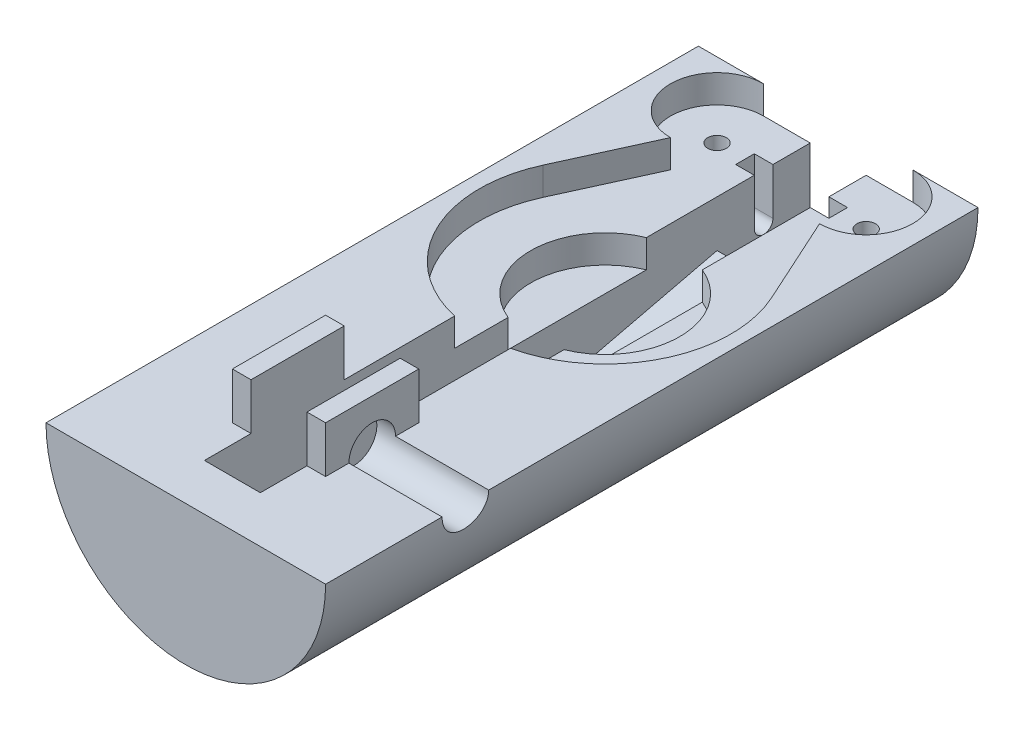
from build123d import *

# Parameters (mm, degrees)
SALIENTE_EXTRUIR1_DEPTH      = 35
SALIENTE_EXTRUIR1_DEPTH_BACK = 35
CORTAR_EXTRUIR1_DEPTH        = 3
CROQUIS4_R                   = 8
CORTAR_EXTRUIR2_DEPTH        = 3
CROQUIS5_R                   = 2.5
CORTAR_EXTRUIR3_DEPTH        = 10
CROQUIS6_W                   = 6
CROQUIS6_H                   = 10
CORTAR_EXTRUIR5_DEPTH        = 10
CROQUIS7_W                   = 2
CROQUIS7_H                   = 2
CORTAR_EXTRUIR6_DEPTH        = 5
CROQUIS8_R                   = 1
CORTAR_EXTRUIR7_DEPTH        = 2
CROQUIS9_W                   = 6
CROQUIS9_H                   = 10
CORTAR_EXTRUIR8_DEPTH        = 12
CORTAR_EXTRUIR9_DEPTH        = 5
CORTAR_EXTRUIR9_DEPTH_BACK   = 5
CROQUIS10_R                  = 1
CORTAR_EXTRUIR10_DEPTH       = 5
CORTAR_EXTRUIR10_DEPTH_BACK  = 5
CORTAR_EXTRUIR11_DEPTH       = 3
CORTAR_EXTRUIR11_DEPTH_BACK  = 3
CROQUIS14_W                  = 2
CROQUIS14_H                  = 10
SALIENTE_EXTRUIR2_DEPTH      = 5
CROQUIS15_R                  = 2.5
CORTAR_EXTRUIR12_DEPTH       = 15


with BuildPart() as part:
    # Croquis1 → Saliente-Extruir1 (new, two sides: drawn at the far end of the back side and taken through both)
    with BuildSketch(Plane.XY.offset(-SALIENTE_EXTRUIR1_DEPTH_BACK)):
        with BuildLine():
            Line((-15, 0), (15, 0))
            ThreePointArc((15, 0), (0, -15), (-15, 0))
        make_face()
    extrude(amount=SALIENTE_EXTRUIR1_DEPTH + SALIENTE_EXTRUIR1_DEPTH_BACK)

    # Croquis3 → Cortar-Extruir1 (cut)
    with BuildSketch(Plane(origin=(0, 0, 0), x_dir=(1, 0, 0), z_dir=(0, 1, 0))):
        with BuildLine():
            Line((-8, 25), (-12.284525276, 15.598253186))
            ThreePointArc((-12.284525276, 15.598253186), (0, -3.5), (12.284525276, 15.598253186))
            Line((12.284525276, 15.598253186), (8, 25))
            ThreePointArc((8, 25), (13, 30), (8, 35))
            Line((8, 35), (-8, 35))
            ThreePointArc((-8, 35), (-13, 30), (-8, 25))
        make_face()
    extrude(amount=-CORTAR_EXTRUIR1_DEPTH, mode=Mode.SUBTRACT)

    # Croquis4 → Cortar-Extruir2 (cut)
    with BuildSketch(Plane(origin=(0, -3, 0), x_dir=(1, 0, 0), z_dir=(0, 1, 0))):
        with Locations((0, 10)):
            Circle(CROQUIS4_R)
    extrude(amount=-CORTAR_EXTRUIR2_DEPTH, mode=Mode.SUBTRACT)

    # Croquis5 → Cortar-Extruir3 (cut)
    with BuildSketch(Plane(origin=(0, -6, 0), x_dir=(1, 0, 0), z_dir=(0, 1, 0))):
        with Locations((0, 10)):
            Circle(CROQUIS5_R)
    extrude(amount=-CORTAR_EXTRUIR3_DEPTH, mode=Mode.SUBTRACT)

    # Croquis6 → Cortar-Extruir5 (cut)
    with BuildSketch(Plane(origin=(0, -3, 0), x_dir=(1, 0, 0), z_dir=(0, 1, 0))):
        with Locations((0, 30)):
            Rectangle(CROQUIS6_W, CROQUIS6_H)
    extrude(amount=-CORTAR_EXTRUIR5_DEPTH, mode=Mode.SUBTRACT)

    # Croquis7 → Cortar-Extruir6 (cut)
    with BuildSketch(Plane(origin=(0, -3, 0), x_dir=(1, 0, 0), z_dir=(0, 1, 0))):
        with Locations((-4, 30)):
            Rectangle(CROQUIS7_W, CROQUIS7_H)
        with Locations((4, 30)):
            Rectangle(CROQUIS7_W, CROQUIS7_H)
    extrude(amount=-CORTAR_EXTRUIR6_DEPTH, mode=Mode.SUBTRACT)

    # Croquis8 → Cortar-Extruir7 (cut)
    with BuildSketch(Plane(origin=(0, -3, 0), x_dir=(1, 0, 0), z_dir=(0, 1, 0))):
        with Locations((-8, 30)):
            Circle(CROQUIS8_R)
        with Locations((8, 30)):
            Circle(CROQUIS8_R)
    extrude(amount=-CORTAR_EXTRUIR7_DEPTH, mode=Mode.SUBTRACT)

    # Croquis9 → Cortar-Extruir8 (cut)
    with BuildSketch(Plane(origin=(0, -3, 0), x_dir=(1, 0, 0), z_dir=(0, 1, 0))):
        Rectangle(CROQUIS9_W, CROQUIS9_H)
    extrude(amount=-CORTAR_EXTRUIR8_DEPTH, mode=Mode.SUBTRACT)

    # Croquis10 → Cortar-Extruir9 (cut, two sides: drawn at the far end of the back side and taken through both)
    with BuildSketch(Plane(origin=(0, 0, 0), x_dir=(0, 0, -1), z_dir=(1, 0, 0)).offset(-CORTAR_EXTRUIR9_DEPTH_BACK)):
        with Locations((30, -8)):
            Circle(CROQUIS10_R)
    extrude(amount=CORTAR_EXTRUIR9_DEPTH + CORTAR_EXTRUIR9_DEPTH_BACK, mode=Mode.SUBTRACT)

    # Croquis11 → Cortar-Extruir10 (cut, two sides: drawn at the far end of the back side and taken through both)
    with BuildSketch(Plane(origin=(0, 0, 0), x_dir=(0, 0, -1), z_dir=(1, 0, 0)).offset(-CORTAR_EXTRUIR10_DEPTH_BACK)):
        with BuildLine():
            Line((-6, -15), (6, -15))
            Line((6, -15), (6, -14))
            Line((6, -14), (1, -14))
            Line((1, -14), (1, -8))
            ThreePointArc((1, -8), (0, -7), (-1, -8))
            Line((-1, -8), (-1, -14))
            Line((-1, -14), (-6, -14))
            Line((-6, -14), (-6, -15))
        make_face()
    extrude(amount=CORTAR_EXTRUIR10_DEPTH + CORTAR_EXTRUIR10_DEPTH_BACK, mode=Mode.SUBTRACT)

    # Croquis12 → Cortar-Extruir11 (cut, two sides: drawn at the far end of the back side and taken through both)
    with BuildSketch(Plane(origin=(0, 0, 0), x_dir=(0, 0, -1), z_dir=(1, 0, 0)).offset(-CORTAR_EXTRUIR11_DEPTH_BACK)):
        with BuildLine():
            Line((-3, -13), (-21.658767316, -9.861464952))
            ThreePointArc((-21.658767316, -9.861464952), (-27.635040051, -6.458030924), (-30, 0))
            Line((-30, 0), (-3, 0))
            Line((-3, 0), (-3, -13))
        make_face()
        Polygon((25, -8), (25, -3), (4, -3), (4, -13), align=None)
    extrude(amount=CORTAR_EXTRUIR11_DEPTH + CORTAR_EXTRUIR11_DEPTH_BACK, mode=Mode.SUBTRACT)

    # Croquis14 → Saliente-Extruir2 (add)
    with BuildSketch(Plane(origin=(0, 0, 0), x_dir=(1, 0, 0), z_dir=(0, 1, 0))):
        with Locations((4, -20)):
            Rectangle(CROQUIS14_W, CROQUIS14_H)
        with Locations((-4, -20)):
            Rectangle(CROQUIS14_W, CROQUIS14_H)
    extrude(amount=SALIENTE_EXTRUIR2_DEPTH)

    # Croquis15 → Cortar-Extruir12 (cut)
    with BuildSketch(Plane(origin=(0, 0, 0), x_dir=(0, 0, -1), z_dir=(1, 0, 0))):
        with Locations((-20, 0)):
            Circle(CROQUIS15_R)
    extrude(amount=CORTAR_EXTRUIR12_DEPTH, mode=Mode.SUBTRACT)


solid = part.part
